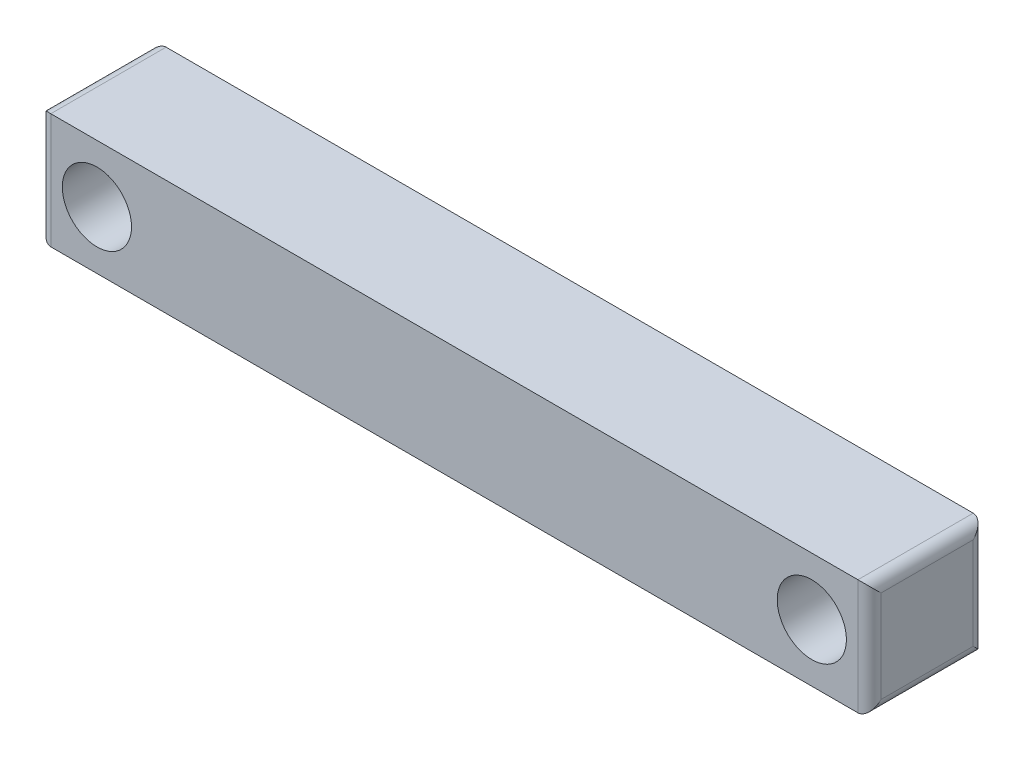
from build123d import *

# Parameters (mm, degrees)
SKETCH1_W           = 180
SKETCH1_H           = 25
SKETCH1_R           = 7.5
BOSS_EXTRUDE1_DEPTH = 25
FILLET1_R           = 2.5
FILLET2_R           = 2.5


with BuildPart() as part:
    # Sketch1 → Boss-Extrude1 (new body)
    with BuildSketch(Plane.XY):
        with Locations((11.116046254, 73.038881715)):
            Rectangle(SKETCH1_W, SKETCH1_H)
        with Locations((-66.383953746, 73.038881715)):
            Circle(SKETCH1_R, mode=Mode.SUBTRACT)
        with Locations((88.616046254, 73.038881715)):
            Circle(SKETCH1_R, mode=Mode.SUBTRACT)
    extrude(amount=BOSS_EXTRUDE1_DEPTH)

    # Fillet1
    fillet1_edges = [part.edges().sort_by_distance(p)[0] for p in [
        (-78.883953746, 73.038881715, 25),
        (-78.883953746, 73.038881715, 0),
        (-78.883953746, 85.538881715, 12.5),
        (-78.883953746, 60.538881715, 12.5),
    ]]
    fillet(fillet1_edges, radius=FILLET1_R)

    # Fillet2
    fillet2_edges = [part.edges().sort_by_distance(p)[0] for p in [
        (101.116046254, 73.038881715, 25),
        (101.116046254, 73.038881715, 0),
        (101.116046254, 85.538881715, 12.5),
        (101.116046254, 60.538881715, 12.5),
    ]]
    fillet(fillet2_edges, radius=FILLET2_R)


solid = part.part
